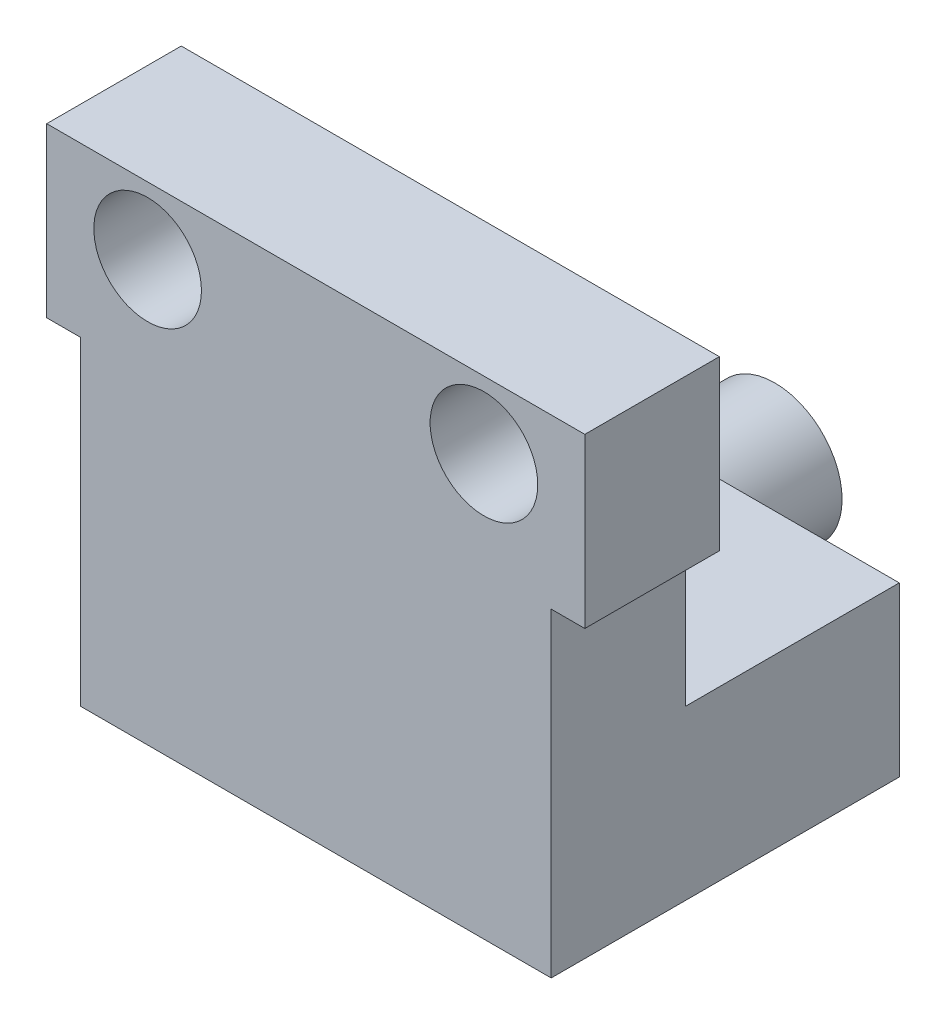
from build123d import *

# Parameters (mm, degrees)
INTEGRATED_START                              = 53
INTEGRATED_HORIZONTAL_STOP_PAD_PROFILE_W      = 16
INTEGRATED_HORIZONTAL_STOP_PAD_PROFILE_H      = 5
INTEGRATED_HORIZONTAL_STOP_PAD_DEPTH          = 4
INTEGRAL_START                                = 53
INTEGRAL_UPRIGHT_PROFILE_W                    = 14
INTEGRAL_UPRIGHT_PROFILE_H                    = 9.7
INTEGRAL_UPRIGHT_DEPTH                        = 4
HORIZONTAL_START                              = 46.65
HORIZONTAL_LIMIT_PIN_ARM_PROFILE_W            = 14
HORIZONTAL_LIMIT_PIN_ARM_PROFILE_H            = 5
HORIZONTAL_LIMIT_PIN_ARM_DEPTH                = 6.55
BUILT_START                                   = 43.35
BUILT_IN_STOP_PIN_DIAMETER_4_MM_PROFILE_R     = 2
BUILT_IN_STOP_PIN_DIAMETER_4_MM_DEPTH         = 3.5
STOP_START                                    = 52.9
STOP_CLEARANCE_TWO_M3_HOLES_10_MM_PI_2_R      = 1.6
STOP_CLEARANCE_TWO_M3_HOLES_10_MM_PITCH_DEPTH = 4.2


with BuildPart() as part:
    # Integrated horizontal stop pad profile → Integrated horizontal stop pad (new body)
    with BuildSketch(Plane.XY.offset(INTEGRATED_START)):
        with Locations((0, 26.5)):
            Rectangle(INTEGRATED_HORIZONTAL_STOP_PAD_PROFILE_W, INTEGRATED_HORIZONTAL_STOP_PAD_PROFILE_H)
    extrude(amount=INTEGRATED_HORIZONTAL_STOP_PAD_DEPTH)

    # Integral upright profile → Integral upright (add)
    with BuildSketch(Plane.XY.offset(INTEGRAL_START)):
        with Locations((0, 19.35)):
            Rectangle(INTEGRAL_UPRIGHT_PROFILE_W, INTEGRAL_UPRIGHT_PROFILE_H)
    extrude(amount=INTEGRAL_UPRIGHT_DEPTH)

    # Horizontal limit pin arm profile → Horizontal limit pin arm (add)
    with BuildSketch(Plane.XY.offset(HORIZONTAL_START)):
        with Locations((0, 17)):
            Rectangle(HORIZONTAL_LIMIT_PIN_ARM_PROFILE_W, HORIZONTAL_LIMIT_PIN_ARM_PROFILE_H)
    extrude(amount=HORIZONTAL_LIMIT_PIN_ARM_DEPTH)

    # Built in stop pin diameter 4 mm profile → Built in stop pin diameter 4 mm (add)
    with BuildSketch(Plane.XY.offset(BUILT_START)):
        with Locations(Location((0, 17.5, 0), (0, 0, 90))):
            Circle(BUILT_IN_STOP_PIN_DIAMETER_4_MM_PROFILE_R)
    extrude(amount=BUILT_IN_STOP_PIN_DIAMETER_4_MM_DEPTH)

    # Stop clearance two M3 holes 10 mm pi 2 → Stop clearance two M3 holes 10 mm pitch (cut)
    with BuildSketch(Plane.XY.offset(STOP_START)):
        with Locations((-5, 27)):
            Circle(STOP_CLEARANCE_TWO_M3_HOLES_10_MM_PI_2_R)
        with Locations((5, 27)):
            Circle(STOP_CLEARANCE_TWO_M3_HOLES_10_MM_PI_2_R)
    extrude(amount=STOP_CLEARANCE_TWO_M3_HOLES_10_MM_PITCH_DEPTH, mode=Mode.SUBTRACT)


solid = part.part
